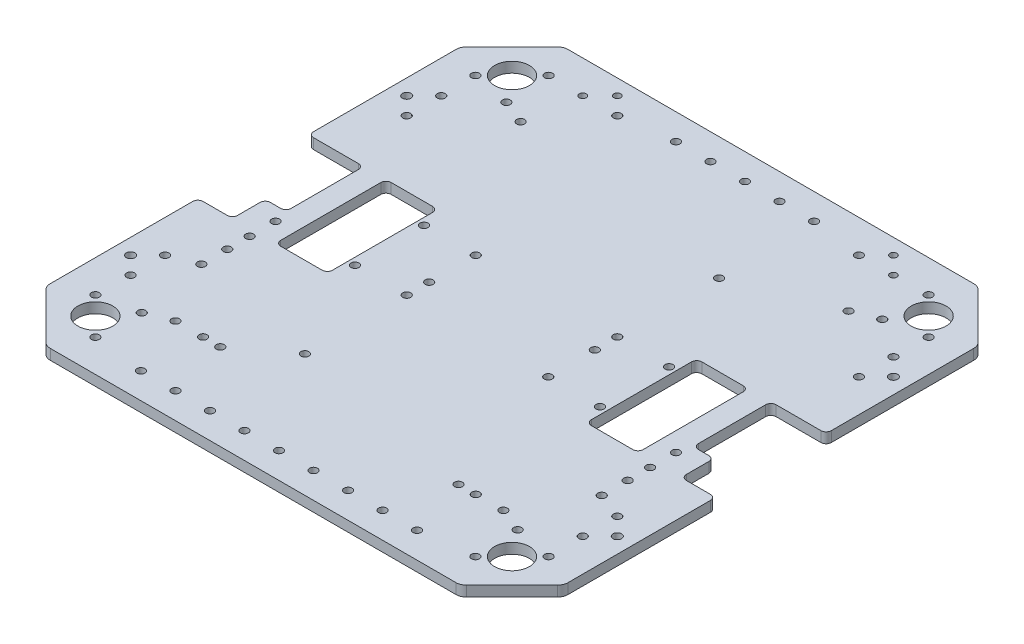
from build123d import *

# Parameters (mm, degrees)
BOSS_EXTRU_1_DEPTH                  = 6
ENL_V_MAT_EXTRU_1_REACH             = 214.217
ESQUISSE2_R                         = 10.1
ESQUISSE2_R_2                       = 2.3
SYM_TRIE2_COPY_1_REACH              = 214.217
SYM_TRIE2_COPY_1_SKETCH_R           = 10.1
SYM_TRIE2_COPY_1_SKETCH_R_2         = 2.3
ENL_V_MAT_EXTRU_2_REACH             = 214.217
ENL_V_MAT_EXTRU_2_DIRECTION_2_DEPTH = 213.216870206
CONG_1_R                            = 3
ENL_V_MAT_EXTRU_3_REACH             = 214.217
CONG_2_R                            = 3
ENL_V_MAT_EXTRU_4_REACH             = 214.217
ESQUISSE5_R                         = 2.3
ENL_V_MAT_EXTRU_5_REACH             = 214.217
ESQUISSE6_R                         = 2.3
ENL_V_MAT_EXTRU_6_REACH             = 214.217
ESQUISSE7_R                         = 2.476946043
ESQUISSE7_R_2                       = 2.3
ENL_V_MAT_EXTRU_7_REACH             = 214.217
ESQUISSE8_R                         = 2.3
ENL_V_MAT_EXTRU_8_REACH             = 214.217
ESQUISSE10_R                        = 2.3
CONG_3_R                            = 6
ENL_V_MAT_EXTRU_9_REACH             = 214.217
ESQUISSE11_R                        = 2.3
ENL_V_MAT_EXTRU_10_REACH            = 214.217
ESQUISSE12_R                        = 2.3
ENL_V_MAT_EXTRU_11_REACH            = 214.217
ESQUISSE13_R                        = 2.3
ENL_V_MAT_EXTRU_12_REACH            = 214.217
ESQUISSE14_R                        = 2.3
ESQUISSE14_R_2                      = 2
ENL_V_MAT_EXTRU_13_REACH            = 214.217
ESQUISSE15_W                        = 15
ESQUISSE15_H                        = 45
CONG_4_R                            = 3


with BuildPart() as part:
    # Esquisse1 → Boss.-Extru.1 (new body)
    with BuildSketch(Plane(origin=(0, 0, 0), x_dir=(1, 0, 0), z_dir=(0, 1, 0))):
        Polygon((-150, 0), (-150, 120), (-120, 150), (0, 150), (120, 150), (150, 120), (150, 0), (150, -120), (120, -150), (0, -150), (-120, -150), (-150, -120), align=None)
    extrude(amount=BOSS_EXTRU_1_DEPTH)

    # Esquisse2 → Enlèv. mat.-Extru.1 (cut, up to next)
    with BuildSketch(Plane(origin=(0, 6, 0), x_dir=(1, 0, 0), z_dir=(0, 1, 0)), mode=Mode.PRIVATE) as enl_v_mat_extru_1_sk1:
        with Locations(Location((-120.69746073, 120.69746073, 0), (0, 0, 270))):
            Circle(ESQUISSE2_R)
    enl_v_mat_extru_1_tool1 = extrude(enl_v_mat_extru_1_sk1.sketch, amount=-ENL_V_MAT_EXTRU_1_REACH, mode=Mode.PRIVATE) & part.part
    # Esquisse2 → Enlèv. mat.-Extru.1 (cut, up to next)
    with BuildSketch(Plane(origin=(0, 6, 0), x_dir=(1, 0, 0), z_dir=(0, 1, 0)), mode=Mode.PRIVATE) as enl_v_mat_extru_1_sk2:
        with Locations(Location((-131.304062448, 110.090859012, 0), (0, 0, 270))):
            Circle(ESQUISSE2_R_2)
    enl_v_mat_extru_1_tool2 = extrude(enl_v_mat_extru_1_sk2.sketch, amount=-ENL_V_MAT_EXTRU_1_REACH, mode=Mode.PRIVATE) & part.part
    # Esquisse2 → Enlèv. mat.-Extru.1 (cut, up to next)
    with BuildSketch(Plane(origin=(0, 6, 0), x_dir=(1, 0, 0), z_dir=(0, 1, 0)), mode=Mode.PRIVATE) as enl_v_mat_extru_1_sk3:
        with Locations(Location((-110.090859012, 131.304062448, 0), (0, 0, 270))):
            Circle(ESQUISSE2_R_2)
    enl_v_mat_extru_1_tool3 = extrude(enl_v_mat_extru_1_sk3.sketch, amount=-ENL_V_MAT_EXTRU_1_REACH, mode=Mode.PRIVATE) & part.part
    enl_v_mat_extru_1_1 = enl_v_mat_extru_1_tool1.solids().sort_by_distance((-120.697461, 6, -120.697461))[0]
    add(enl_v_mat_extru_1_1, mode=Mode.SUBTRACT)
    enl_v_mat_extru_1_2 = enl_v_mat_extru_1_tool2.solids().sort_by_distance((-131.304062, 6, -110.090859))[0]
    add(enl_v_mat_extru_1_2, mode=Mode.SUBTRACT)
    enl_v_mat_extru_1_3 = enl_v_mat_extru_1_tool3.solids().sort_by_distance((-110.090859, 6, -131.304062))[0]
    add(enl_v_mat_extru_1_3, mode=Mode.SUBTRACT)
    enl_v_mat_extru_1 = enl_v_mat_extru_1_1 + enl_v_mat_extru_1_2 + enl_v_mat_extru_1_3  # Enlèv. mat.-Extru.1 as one shape, for the pattern or mirror that repeats it

    # Symétrie1: Enlèv. mat.-Extru.1 across plane
    add(enl_v_mat_extru_1.mirror(Plane(origin=(0, 0, 0), x_dir=(0, 0, 1), z_dir=(1, 0, 0))), mode=Mode.SUBTRACT)

    # Symétrie2: Enlèv. mat.-Extru.1 across plane
    add(enl_v_mat_extru_1.mirror(Plane.XY), mode=Mode.SUBTRACT)

    # Symétrie2 copy 1 sketch → Symétrie2 copy 1 (cut, up to next)
    with BuildSketch(Plane(origin=(0, 6, 0), x_dir=(-1, 0, 0), z_dir=(0, 1, 0)), mode=Mode.PRIVATE) as sym_trie2_copy_1_sk1:
        with Locations(Location((-120.69746073, 120.69746073, 0), (0, 0, 270))):
            Circle(SYM_TRIE2_COPY_1_SKETCH_R)
    sym_trie2_copy_1_tool1 = extrude(sym_trie2_copy_1_sk1.sketch, amount=-SYM_TRIE2_COPY_1_REACH, mode=Mode.PRIVATE) & part.part
    # Symétrie2 copy 1 sketch → Symétrie2 copy 1 (cut, up to next)
    with BuildSketch(Plane(origin=(0, 6, 0), x_dir=(-1, 0, 0), z_dir=(0, 1, 0)), mode=Mode.PRIVATE) as sym_trie2_copy_1_sk2:
        with Locations(Location((-131.304062448, 110.090859012, 0), (0, 0, 270))):
            Circle(SYM_TRIE2_COPY_1_SKETCH_R_2)
    sym_trie2_copy_1_tool2 = extrude(sym_trie2_copy_1_sk2.sketch, amount=-SYM_TRIE2_COPY_1_REACH, mode=Mode.PRIVATE) & part.part
    # Symétrie2 copy 1 sketch → Symétrie2 copy 1 (cut, up to next)
    with BuildSketch(Plane(origin=(0, 6, 0), x_dir=(-1, 0, 0), z_dir=(0, 1, 0)), mode=Mode.PRIVATE) as sym_trie2_copy_1_sk3:
        with Locations(Location((-110.090859012, 131.304062448, 0), (0, 0, 270))):
            Circle(SYM_TRIE2_COPY_1_SKETCH_R_2)
    sym_trie2_copy_1_tool3 = extrude(sym_trie2_copy_1_sk3.sketch, amount=-SYM_TRIE2_COPY_1_REACH, mode=Mode.PRIVATE) & part.part
    add(sym_trie2_copy_1_tool1.solids().sort_by_distance((120.697461, 6, 120.697461))[0], mode=Mode.SUBTRACT)
    add(sym_trie2_copy_1_tool2.solids().sort_by_distance((131.304062, 6, 110.090859))[0], mode=Mode.SUBTRACT)
    add(sym_trie2_copy_1_tool3.solids().sort_by_distance((110.090859, 6, 131.304062))[0], mode=Mode.SUBTRACT)

    # Esquisse3 → Enlèv. mat.-Extru.2 (cut, up to next)
    with BuildSketch(Plane(origin=(0, 6, 0), x_dir=(1, 0, 0), z_dir=(0, 1, 0)), mode=Mode.PRIVATE) as enl_v_mat_extru_2_sk1:
        Polygon((-150, 0), (-150, -32), (-130, -32), (-130, 32), (-150, 32), align=None)
    enl_v_mat_extru_2_tool1 = extrude(enl_v_mat_extru_2_sk1.sketch, amount=-ENL_V_MAT_EXTRU_2_REACH, mode=Mode.PRIVATE) & part.part
    enl_v_mat_extru_2 = enl_v_mat_extru_2_tool1.solids().sort_by_distance((-140, 6, 0))[0]
    add(enl_v_mat_extru_2, mode=Mode.SUBTRACT)

    # Esquisse3 → Enlèv. mat.-Extru.2 direction 2 (cut)
    with BuildSketch(Plane(origin=(0, 6, 0), x_dir=(1, 0, 0), z_dir=(0, 1, 0))):
        Polygon((-150, 0), (-150, -32), (-130, -32), (-130, 32), (-150, 32), align=None)
    enl_v_mat_extru_2_direction_2 = extrude(amount=ENL_V_MAT_EXTRU_2_DIRECTION_2_DEPTH, mode=Mode.SUBTRACT)

    # Symétrie3: Enlèv. mat.-Extru.2, Enlèv. mat.-Extru.2 direction 2 across plane
    add(enl_v_mat_extru_2.mirror(Plane(origin=(0, 0, 0), x_dir=(0, 0, 1), z_dir=(1, 0, 0))), mode=Mode.SUBTRACT)
    add(enl_v_mat_extru_2_direction_2.mirror(Plane(origin=(0, 0, 0), x_dir=(0, 0, 1), z_dir=(1, 0, 0))), mode=Mode.SUBTRACT)

    # Congé1
    cong_1_edges = [part.edges().sort_by_distance(p)[0] for p in [
        (150, 3, 32),
        (150, 3, -32),
        (130, 3, -32),
        (130, 3, 32),
        (-150, 3, -32),
        (-150, 3, 32),
        (-130, 3, 32),
        (-130, 3, -32),
    ]]
    fillet(cong_1_edges, radius=CONG_1_R)

    # Esquisse4 → Enlèv. mat.-Extru.3 (cut, up to next)
    with BuildSketch(Plane(origin=(0, 6, 0), x_dir=(1, 0, 0), z_dir=(0, 1, 0)), mode=Mode.PRIVATE) as enl_v_mat_extru_3_sk1:
        Polygon((-105, 0), (-105, 32), (-75, 32), (-75, -32), (-105, -32), align=None)
    enl_v_mat_extru_3_tool1 = extrude(enl_v_mat_extru_3_sk1.sketch, amount=-ENL_V_MAT_EXTRU_3_REACH, mode=Mode.PRIVATE) & part.part
    enl_v_mat_extru_3 = enl_v_mat_extru_3_tool1.solids().sort_by_distance((-90, 6, 0))[0]
    add(enl_v_mat_extru_3, mode=Mode.SUBTRACT)

    # Symétrie4: Enlèv. mat.-Extru.3 across plane
    add(enl_v_mat_extru_3.mirror(Plane(origin=(0, 0, 0), x_dir=(0, 0, 1), z_dir=(1, 0, 0))), mode=Mode.SUBTRACT)

    # Congé2
    cong_2_edges = [part.edges().sort_by_distance(p)[0] for p in [
        (-105, 3, -32),
        (-75, 3, -32),
        (-75, 3, 32),
        (-105, 3, 32),
        (75, 3, -32),
        (105, 3, -32),
        (105, 3, 32),
        (75, 3, 32),
    ]]
    fillet(cong_2_edges, radius=CONG_2_R)

    # Esquisse5 → Enlèv. mat.-Extru.4 (cut, up to next)
    with BuildSketch(Plane(origin=(0, 6, 0), x_dir=(1, 0, 0), z_dir=(0, 1, 0)), mode=Mode.PRIVATE) as enl_v_mat_extru_4_sk1:
        with Locations(Location((-71, 20, 0), (0, 0, 270))):
            Circle(ESQUISSE5_R)
    enl_v_mat_extru_4_tool1 = extrude(enl_v_mat_extru_4_sk1.sketch, amount=-ENL_V_MAT_EXTRU_4_REACH, mode=Mode.PRIVATE) & part.part
    # Esquisse5 → Enlèv. mat.-Extru.4 (cut, up to next)
    with BuildSketch(Plane(origin=(0, 6, 0), x_dir=(1, 0, 0), z_dir=(0, 1, 0)), mode=Mode.PRIVATE) as enl_v_mat_extru_4_sk2:
        with Locations(Location((-71, -20, 0), (0, 0, 270))):
            Circle(ESQUISSE5_R)
    enl_v_mat_extru_4_tool2 = extrude(enl_v_mat_extru_4_sk2.sketch, amount=-ENL_V_MAT_EXTRU_4_REACH, mode=Mode.PRIVATE) & part.part
    enl_v_mat_extru_4_1 = enl_v_mat_extru_4_tool1.solids().sort_by_distance((-71, 6, -20))[0]
    add(enl_v_mat_extru_4_1, mode=Mode.SUBTRACT)
    enl_v_mat_extru_4_2 = enl_v_mat_extru_4_tool2.solids().sort_by_distance((-71, 6, 20))[0]
    add(enl_v_mat_extru_4_2, mode=Mode.SUBTRACT)
    enl_v_mat_extru_4 = enl_v_mat_extru_4_1 + enl_v_mat_extru_4_2  # Enlèv. mat.-Extru.4 as one shape, for the pattern or mirror that repeats it

    # Symétrie5: Enlèv. mat.-Extru.4 across plane
    add(enl_v_mat_extru_4.mirror(Plane(origin=(0, 0, 0), x_dir=(0, 0, 1), z_dir=(1, 0, 0))), mode=Mode.SUBTRACT)

    # Esquisse6 → Enlèv. mat.-Extru.5 (cut, up to next)
    with BuildSketch(Plane(origin=(0, 6, 0), x_dir=(1, 0, 0), z_dir=(0, 1, 0)), mode=Mode.PRIVATE) as enl_v_mat_extru_5_sk1:
        with Locations(Location((-41, -79, 0), (0, 0, 270))):
            Circle(ESQUISSE6_R)
    enl_v_mat_extru_5_tool1 = extrude(enl_v_mat_extru_5_sk1.sketch, amount=-ENL_V_MAT_EXTRU_5_REACH, mode=Mode.PRIVATE) & part.part
    # Esquisse6 → Enlèv. mat.-Extru.5 (cut, up to next)
    with BuildSketch(Plane(origin=(0, 6, 0), x_dir=(1, 0, 0), z_dir=(0, 1, 0)), mode=Mode.PRIVATE) as enl_v_mat_extru_5_sk2:
        with Locations(Location((-41, -20, 0), (0, 0, 270))):
            Circle(ESQUISSE6_R)
    enl_v_mat_extru_5_tool2 = extrude(enl_v_mat_extru_5_sk2.sketch, amount=-ENL_V_MAT_EXTRU_5_REACH, mode=Mode.PRIVATE) & part.part
    # Esquisse6 → Enlèv. mat.-Extru.5 (cut, up to next)
    with BuildSketch(Plane(origin=(0, 6, 0), x_dir=(1, 0, 0), z_dir=(0, 1, 0)), mode=Mode.PRIVATE) as enl_v_mat_extru_5_sk3:
        with Locations(Location((-41, 20, 0), (0, 0, 270))):
            Circle(ESQUISSE6_R)
    enl_v_mat_extru_5_tool3 = extrude(enl_v_mat_extru_5_sk3.sketch, amount=-ENL_V_MAT_EXTRU_5_REACH, mode=Mode.PRIVATE) & part.part
    # Esquisse6 → Enlèv. mat.-Extru.5 (cut, up to next)
    with BuildSketch(Plane(origin=(0, 6, 0), x_dir=(1, 0, 0), z_dir=(0, 1, 0)), mode=Mode.PRIVATE) as enl_v_mat_extru_5_sk4:
        with Locations(Location((41, -20, 0), (0, 0, 270))):
            Circle(ESQUISSE6_R)
    enl_v_mat_extru_5_tool4 = extrude(enl_v_mat_extru_5_sk4.sketch, amount=-ENL_V_MAT_EXTRU_5_REACH, mode=Mode.PRIVATE) & part.part
    # Esquisse6 → Enlèv. mat.-Extru.5 (cut, up to next)
    with BuildSketch(Plane(origin=(0, 6, 0), x_dir=(1, 0, 0), z_dir=(0, 1, 0)), mode=Mode.PRIVATE) as enl_v_mat_extru_5_sk5:
        with Locations(Location((41, 79, 0), (0, 0, 270))):
            Circle(ESQUISSE6_R)
    enl_v_mat_extru_5_tool5 = extrude(enl_v_mat_extru_5_sk5.sketch, amount=-ENL_V_MAT_EXTRU_5_REACH, mode=Mode.PRIVATE) & part.part
    # Esquisse6 → Enlèv. mat.-Extru.5 (cut, up to next)
    with BuildSketch(Plane(origin=(0, 6, 0), x_dir=(1, 0, 0), z_dir=(0, 1, 0)), mode=Mode.PRIVATE) as enl_v_mat_extru_5_sk6:
        with Locations(Location((41, 20, 0), (0, 0, 270))):
            Circle(ESQUISSE6_R)
    enl_v_mat_extru_5_tool6 = extrude(enl_v_mat_extru_5_sk6.sketch, amount=-ENL_V_MAT_EXTRU_5_REACH, mode=Mode.PRIVATE) & part.part
    # Esquisse6 → Enlèv. mat.-Extru.5 (cut, up to next)
    with BuildSketch(Plane(origin=(0, 6, 0), x_dir=(1, 0, 0), z_dir=(0, 1, 0)), mode=Mode.PRIVATE) as enl_v_mat_extru_5_sk7:
        with Locations(Location((41, 7, 0), (0, 0, 270))):
            Circle(ESQUISSE6_R)
    enl_v_mat_extru_5_tool7 = extrude(enl_v_mat_extru_5_sk7.sketch, amount=-ENL_V_MAT_EXTRU_5_REACH, mode=Mode.PRIVATE) & part.part
    # Esquisse6 → Enlèv. mat.-Extru.5 (cut, up to next)
    with BuildSketch(Plane(origin=(0, 6, 0), x_dir=(1, 0, 0), z_dir=(0, 1, 0)), mode=Mode.PRIVATE) as enl_v_mat_extru_5_sk8:
        with Locations(Location((-41, -7, 0), (0, 0, 270))):
            Circle(ESQUISSE6_R)
    enl_v_mat_extru_5_tool8 = extrude(enl_v_mat_extru_5_sk8.sketch, amount=-ENL_V_MAT_EXTRU_5_REACH, mode=Mode.PRIVATE) & part.part
    add(enl_v_mat_extru_5_tool1.solids().sort_by_distance((-41, 6, 79))[0], mode=Mode.SUBTRACT)
    add(enl_v_mat_extru_5_tool2.solids().sort_by_distance((-41, 6, 20))[0], mode=Mode.SUBTRACT)
    add(enl_v_mat_extru_5_tool3.solids().sort_by_distance((-41, 6, -20))[0], mode=Mode.SUBTRACT)
    add(enl_v_mat_extru_5_tool4.solids().sort_by_distance((41, 6, 20))[0], mode=Mode.SUBTRACT)
    add(enl_v_mat_extru_5_tool5.solids().sort_by_distance((41, 6, -79))[0], mode=Mode.SUBTRACT)
    add(enl_v_mat_extru_5_tool6.solids().sort_by_distance((41, 6, -20))[0], mode=Mode.SUBTRACT)
    add(enl_v_mat_extru_5_tool7.solids().sort_by_distance((41, 6, -7))[0], mode=Mode.SUBTRACT)
    add(enl_v_mat_extru_5_tool8.solids().sort_by_distance((-41, 6, 7))[0], mode=Mode.SUBTRACT)

    # Esquisse7 → Enlèv. mat.-Extru.6 (cut, up to next)
    with BuildSketch(Plane(origin=(0, 6, 0), x_dir=(1, 0, 0), z_dir=(0, 1, 0)), mode=Mode.PRIVATE) as enl_v_mat_extru_6_sk1:
        with Locations(Location((141, -80, 0), (0, 0, 270))):
            Circle(ESQUISSE7_R)
    enl_v_mat_extru_6_tool1 = extrude(enl_v_mat_extru_6_sk1.sketch, amount=-ENL_V_MAT_EXTRU_6_REACH, mode=Mode.PRIVATE) & part.part
    # Esquisse7 → Enlèv. mat.-Extru.6 (cut, up to next)
    with BuildSketch(Plane(origin=(0, 6, 0), x_dir=(1, 0, 0), z_dir=(0, 1, 0)), mode=Mode.PRIVATE) as enl_v_mat_extru_6_sk2:
        with Locations(Location((131, -90, 0), (0, 0, 270))):
            Circle(ESQUISSE7_R_2)
    enl_v_mat_extru_6_tool2 = extrude(enl_v_mat_extru_6_sk2.sketch, amount=-ENL_V_MAT_EXTRU_6_REACH, mode=Mode.PRIVATE) & part.part
    # Esquisse7 → Enlèv. mat.-Extru.6 (cut, up to next)
    with BuildSketch(Plane(origin=(0, 6, 0), x_dir=(1, 0, 0), z_dir=(0, 1, 0)), mode=Mode.PRIVATE) as enl_v_mat_extru_6_sk3:
        with Locations(Location((131, -70, 0), (0, 0, 270))):
            Circle(ESQUISSE7_R_2)
    enl_v_mat_extru_6_tool3 = extrude(enl_v_mat_extru_6_sk3.sketch, amount=-ENL_V_MAT_EXTRU_6_REACH, mode=Mode.PRIVATE) & part.part
    # Esquisse7 → Enlèv. mat.-Extru.6 (cut, up to next)
    with BuildSketch(Plane(origin=(0, 6, 0), x_dir=(1, 0, 0), z_dir=(0, 1, 0)), mode=Mode.PRIVATE) as enl_v_mat_extru_6_sk4:
        with Locations(Location((131, 70, 0), (0, 0, 270))):
            Circle(ESQUISSE7_R_2)
    enl_v_mat_extru_6_tool4 = extrude(enl_v_mat_extru_6_sk4.sketch, amount=-ENL_V_MAT_EXTRU_6_REACH, mode=Mode.PRIVATE) & part.part
    # Esquisse7 → Enlèv. mat.-Extru.6 (cut, up to next)
    with BuildSketch(Plane(origin=(0, 6, 0), x_dir=(1, 0, 0), z_dir=(0, 1, 0)), mode=Mode.PRIVATE) as enl_v_mat_extru_6_sk5:
        with Locations(Location((131, 90, 0), (0, 0, 270))):
            Circle(ESQUISSE7_R_2)
    enl_v_mat_extru_6_tool5 = extrude(enl_v_mat_extru_6_sk5.sketch, amount=-ENL_V_MAT_EXTRU_6_REACH, mode=Mode.PRIVATE) & part.part
    # Esquisse7 → Enlèv. mat.-Extru.6 (cut, up to next)
    with BuildSketch(Plane(origin=(0, 6, 0), x_dir=(1, 0, 0), z_dir=(0, 1, 0)), mode=Mode.PRIVATE) as enl_v_mat_extru_6_sk6:
        with Locations(Location((141, 80, 0), (0, 0, 270))):
            Circle(ESQUISSE7_R)
    enl_v_mat_extru_6_tool6 = extrude(enl_v_mat_extru_6_sk6.sketch, amount=-ENL_V_MAT_EXTRU_6_REACH, mode=Mode.PRIVATE) & part.part
    enl_v_mat_extru_6_1 = enl_v_mat_extru_6_tool1.solids().sort_by_distance((141, 6, 80))[0]
    add(enl_v_mat_extru_6_1, mode=Mode.SUBTRACT)
    enl_v_mat_extru_6_2 = enl_v_mat_extru_6_tool2.solids().sort_by_distance((131, 6, 90))[0]
    add(enl_v_mat_extru_6_2, mode=Mode.SUBTRACT)
    enl_v_mat_extru_6_3 = enl_v_mat_extru_6_tool3.solids().sort_by_distance((131, 6, 70))[0]
    add(enl_v_mat_extru_6_3, mode=Mode.SUBTRACT)
    enl_v_mat_extru_6_4 = enl_v_mat_extru_6_tool4.solids().sort_by_distance((131, 6, -70))[0]
    add(enl_v_mat_extru_6_4, mode=Mode.SUBTRACT)
    enl_v_mat_extru_6_5 = enl_v_mat_extru_6_tool5.solids().sort_by_distance((131, 6, -90))[0]
    add(enl_v_mat_extru_6_5, mode=Mode.SUBTRACT)
    enl_v_mat_extru_6_6 = enl_v_mat_extru_6_tool6.solids().sort_by_distance((141, 6, -80))[0]
    add(enl_v_mat_extru_6_6, mode=Mode.SUBTRACT)
    enl_v_mat_extru_6 = enl_v_mat_extru_6_1 + enl_v_mat_extru_6_2 + enl_v_mat_extru_6_3 + enl_v_mat_extru_6_4 + enl_v_mat_extru_6_5 + enl_v_mat_extru_6_6  # Enlèv. mat.-Extru.6 as one shape, for the pattern or mirror that repeats it

    # Symétrie6: Enlèv. mat.-Extru.6 across plane
    add(enl_v_mat_extru_6.mirror(Plane(origin=(0, 0, 0), x_dir=(0, 0, 1), z_dir=(1, 0, 0))), mode=Mode.SUBTRACT)

    # Esquisse8 → Enlèv. mat.-Extru.7 (cut, up to next)
    with BuildSketch(Plane(origin=(0, 6, 0), x_dir=(1, 0, 0), z_dir=(0, 1, 0)), mode=Mode.PRIVATE) as enl_v_mat_extru_7_sk1:
        with Locations(Location((-80, -135, 0), (0, 0, 270))):
            Circle(ESQUISSE8_R)
    enl_v_mat_extru_7_tool1 = extrude(enl_v_mat_extru_7_sk1.sketch, amount=-ENL_V_MAT_EXTRU_7_REACH, mode=Mode.PRIVATE) & part.part
    # Esquisse8 → Enlèv. mat.-Extru.7 (cut, up to next)
    with BuildSketch(Plane(origin=(0, 6, 0), x_dir=(1, 0, 0), z_dir=(0, 1, 0)), mode=Mode.PRIVATE) as enl_v_mat_extru_7_sk2:
        with Locations(Location((80, -135, 0), (0, 0, 270))):
            Circle(ESQUISSE8_R)
    enl_v_mat_extru_7_tool2 = extrude(enl_v_mat_extru_7_sk2.sketch, amount=-ENL_V_MAT_EXTRU_7_REACH, mode=Mode.PRIVATE) & part.part
    # Esquisse8 → Enlèv. mat.-Extru.7 (cut, up to next)
    with BuildSketch(Plane(origin=(0, 6, 0), x_dir=(1, 0, 0), z_dir=(0, 1, 0)), mode=Mode.PRIVATE) as enl_v_mat_extru_7_sk3:
        with Locations(Location((-60, -135, 0), (0, 0, 270))):
            Circle(ESQUISSE8_R)
    enl_v_mat_extru_7_tool3 = extrude(enl_v_mat_extru_7_sk3.sketch, amount=-ENL_V_MAT_EXTRU_7_REACH, mode=Mode.PRIVATE) & part.part
    # Esquisse8 → Enlèv. mat.-Extru.7 (cut, up to next)
    with BuildSketch(Plane(origin=(0, 6, 0), x_dir=(1, 0, 0), z_dir=(0, 1, 0)), mode=Mode.PRIVATE) as enl_v_mat_extru_7_sk4:
        with Locations(Location((-40, -135, 0), (0, 0, 270))):
            Circle(ESQUISSE8_R)
    enl_v_mat_extru_7_tool4 = extrude(enl_v_mat_extru_7_sk4.sketch, amount=-ENL_V_MAT_EXTRU_7_REACH, mode=Mode.PRIVATE) & part.part
    # Esquisse8 → Enlèv. mat.-Extru.7 (cut, up to next)
    with BuildSketch(Plane(origin=(0, 6, 0), x_dir=(1, 0, 0), z_dir=(0, 1, 0)), mode=Mode.PRIVATE) as enl_v_mat_extru_7_sk5:
        with Locations(Location((-20, -135, 0), (0, 0, 270))):
            Circle(ESQUISSE8_R)
    enl_v_mat_extru_7_tool5 = extrude(enl_v_mat_extru_7_sk5.sketch, amount=-ENL_V_MAT_EXTRU_7_REACH, mode=Mode.PRIVATE) & part.part
    # Esquisse8 → Enlèv. mat.-Extru.7 (cut, up to next)
    with BuildSketch(Plane(origin=(0, 6, 0), x_dir=(1, 0, 0), z_dir=(0, 1, 0)), mode=Mode.PRIVATE) as enl_v_mat_extru_7_sk6:
        with Locations(Location((0, -135, 0), (0, 0, 270))):
            Circle(ESQUISSE8_R)
    enl_v_mat_extru_7_tool6 = extrude(enl_v_mat_extru_7_sk6.sketch, amount=-ENL_V_MAT_EXTRU_7_REACH, mode=Mode.PRIVATE) & part.part
    # Esquisse8 → Enlèv. mat.-Extru.7 (cut, up to next)
    with BuildSketch(Plane(origin=(0, 6, 0), x_dir=(1, 0, 0), z_dir=(0, 1, 0)), mode=Mode.PRIVATE) as enl_v_mat_extru_7_sk7:
        with Locations(Location((20, -135, 0), (0, 0, 270))):
            Circle(ESQUISSE8_R)
    enl_v_mat_extru_7_tool7 = extrude(enl_v_mat_extru_7_sk7.sketch, amount=-ENL_V_MAT_EXTRU_7_REACH, mode=Mode.PRIVATE) & part.part
    # Esquisse8 → Enlèv. mat.-Extru.7 (cut, up to next)
    with BuildSketch(Plane(origin=(0, 6, 0), x_dir=(1, 0, 0), z_dir=(0, 1, 0)), mode=Mode.PRIVATE) as enl_v_mat_extru_7_sk8:
        with Locations(Location((40, -135, 0), (0, 0, 270))):
            Circle(ESQUISSE8_R)
    enl_v_mat_extru_7_tool8 = extrude(enl_v_mat_extru_7_sk8.sketch, amount=-ENL_V_MAT_EXTRU_7_REACH, mode=Mode.PRIVATE) & part.part
    # Esquisse8 → Enlèv. mat.-Extru.7 (cut, up to next)
    with BuildSketch(Plane(origin=(0, 6, 0), x_dir=(1, 0, 0), z_dir=(0, 1, 0)), mode=Mode.PRIVATE) as enl_v_mat_extru_7_sk9:
        with Locations(Location((60, -135, 0), (0, 0, 270))):
            Circle(ESQUISSE8_R)
    enl_v_mat_extru_7_tool9 = extrude(enl_v_mat_extru_7_sk9.sketch, amount=-ENL_V_MAT_EXTRU_7_REACH, mode=Mode.PRIVATE) & part.part
    # Esquisse8 → Enlèv. mat.-Extru.7 (cut, up to next)
    with BuildSketch(Plane(origin=(0, 6, 0), x_dir=(1, 0, 0), z_dir=(0, 1, 0)), mode=Mode.PRIVATE) as enl_v_mat_extru_7_sk10:
        with Locations(Location((40, 135, 0), (0, 0, 270))):
            Circle(ESQUISSE8_R)
    enl_v_mat_extru_7_tool10 = extrude(enl_v_mat_extru_7_sk10.sketch, amount=-ENL_V_MAT_EXTRU_7_REACH, mode=Mode.PRIVATE) & part.part
    # Esquisse8 → Enlèv. mat.-Extru.7 (cut, up to next)
    with BuildSketch(Plane(origin=(0, 6, 0), x_dir=(1, 0, 0), z_dir=(0, 1, 0)), mode=Mode.PRIVATE) as enl_v_mat_extru_7_sk11:
        with Locations(Location((20, 135, 0), (0, 0, 270))):
            Circle(ESQUISSE8_R)
    enl_v_mat_extru_7_tool11 = extrude(enl_v_mat_extru_7_sk11.sketch, amount=-ENL_V_MAT_EXTRU_7_REACH, mode=Mode.PRIVATE) & part.part
    # Esquisse8 → Enlèv. mat.-Extru.7 (cut, up to next)
    with BuildSketch(Plane(origin=(0, 6, 0), x_dir=(1, 0, 0), z_dir=(0, 1, 0)), mode=Mode.PRIVATE) as enl_v_mat_extru_7_sk12:
        with Locations(Location((0, 135, 0), (0, 0, 270))):
            Circle(ESQUISSE8_R)
    enl_v_mat_extru_7_tool12 = extrude(enl_v_mat_extru_7_sk12.sketch, amount=-ENL_V_MAT_EXTRU_7_REACH, mode=Mode.PRIVATE) & part.part
    # Esquisse8 → Enlèv. mat.-Extru.7 (cut, up to next)
    with BuildSketch(Plane(origin=(0, 6, 0), x_dir=(1, 0, 0), z_dir=(0, 1, 0)), mode=Mode.PRIVATE) as enl_v_mat_extru_7_sk13:
        with Locations(Location((-20, 135, 0), (0, 0, 270))):
            Circle(ESQUISSE8_R)
    enl_v_mat_extru_7_tool13 = extrude(enl_v_mat_extru_7_sk13.sketch, amount=-ENL_V_MAT_EXTRU_7_REACH, mode=Mode.PRIVATE) & part.part
    # Esquisse8 → Enlèv. mat.-Extru.7 (cut, up to next)
    with BuildSketch(Plane(origin=(0, 6, 0), x_dir=(1, 0, 0), z_dir=(0, 1, 0)), mode=Mode.PRIVATE) as enl_v_mat_extru_7_sk14:
        with Locations(Location((-40, 135, 0), (0, 0, 270))):
            Circle(ESQUISSE8_R)
    enl_v_mat_extru_7_tool14 = extrude(enl_v_mat_extru_7_sk14.sketch, amount=-ENL_V_MAT_EXTRU_7_REACH, mode=Mode.PRIVATE) & part.part
    add(enl_v_mat_extru_7_tool1.solids().sort_by_distance((-80, 6, 135))[0], mode=Mode.SUBTRACT)
    add(enl_v_mat_extru_7_tool2.solids().sort_by_distance((80, 6, 135))[0], mode=Mode.SUBTRACT)
    add(enl_v_mat_extru_7_tool3.solids().sort_by_distance((-60, 6, 135))[0], mode=Mode.SUBTRACT)
    add(enl_v_mat_extru_7_tool4.solids().sort_by_distance((-40, 6, 135))[0], mode=Mode.SUBTRACT)
    add(enl_v_mat_extru_7_tool5.solids().sort_by_distance((-20, 6, 135))[0], mode=Mode.SUBTRACT)
    add(enl_v_mat_extru_7_tool6.solids().sort_by_distance((0, 6, 135))[0], mode=Mode.SUBTRACT)
    add(enl_v_mat_extru_7_tool7.solids().sort_by_distance((20, 6, 135))[0], mode=Mode.SUBTRACT)
    add(enl_v_mat_extru_7_tool8.solids().sort_by_distance((40, 6, 135))[0], mode=Mode.SUBTRACT)
    add(enl_v_mat_extru_7_tool9.solids().sort_by_distance((60, 6, 135))[0], mode=Mode.SUBTRACT)
    add(enl_v_mat_extru_7_tool10.solids().sort_by_distance((40, 6, -135))[0], mode=Mode.SUBTRACT)
    add(enl_v_mat_extru_7_tool11.solids().sort_by_distance((20, 6, -135))[0], mode=Mode.SUBTRACT)
    add(enl_v_mat_extru_7_tool12.solids().sort_by_distance((0, 6, -135))[0], mode=Mode.SUBTRACT)
    add(enl_v_mat_extru_7_tool13.solids().sort_by_distance((-20, 6, -135))[0], mode=Mode.SUBTRACT)
    add(enl_v_mat_extru_7_tool14.solids().sort_by_distance((-40, 6, -135))[0], mode=Mode.SUBTRACT)

    # Esquisse10 → Enlèv. mat.-Extru.8 (cut, up to next)
    with BuildSketch(Plane(origin=(0, 6, 0), x_dir=(1, 0, 0), z_dir=(0, 1, 0)), mode=Mode.PRIVATE) as enl_v_mat_extru_8_sk1:
        with Locations(Location((-116, -36, 0), (0, 0, 270))):
            Circle(ESQUISSE10_R)
    enl_v_mat_extru_8_tool1 = extrude(enl_v_mat_extru_8_sk1.sketch, amount=-ENL_V_MAT_EXTRU_8_REACH, mode=Mode.PRIVATE) & part.part
    # Esquisse10 → Enlèv. mat.-Extru.8 (cut, up to next)
    with BuildSketch(Plane(origin=(0, 6, 0), x_dir=(1, 0, 0), z_dir=(0, 1, 0)), mode=Mode.PRIVATE) as enl_v_mat_extru_8_sk2:
        with Locations(Location((-116, -64, 0), (0, 0, 270))):
            Circle(ESQUISSE10_R)
    enl_v_mat_extru_8_tool2 = extrude(enl_v_mat_extru_8_sk2.sketch, amount=-ENL_V_MAT_EXTRU_8_REACH, mode=Mode.PRIVATE) & part.part
    enl_v_mat_extru_8_1 = enl_v_mat_extru_8_tool1.solids().sort_by_distance((-116, 6, 36))[0]
    add(enl_v_mat_extru_8_1, mode=Mode.SUBTRACT)
    enl_v_mat_extru_8_2 = enl_v_mat_extru_8_tool2.solids().sort_by_distance((-116, 6, 64))[0]
    add(enl_v_mat_extru_8_2, mode=Mode.SUBTRACT)
    enl_v_mat_extru_8 = enl_v_mat_extru_8_1 + enl_v_mat_extru_8_2  # Enlèv. mat.-Extru.8 as one shape, for the pattern or mirror that repeats it

    # Symétrie8: Enlèv. mat.-Extru.8 across plane
    add(enl_v_mat_extru_8.mirror(Plane(origin=(0, 0, 0), x_dir=(0, 0, 1), z_dir=(1, 0, 0))), mode=Mode.SUBTRACT)

    # Congé3
    cong_3_edges = [part.edges().sort_by_distance(p)[0] for p in [
        (-150, 3, -120),
        (-120, 3, -150),
        (120, 3, -150),
        (150, 3, -120),
        (150, 3, 120),
        (120, 3, 150),
        (-120, 3, 150),
        (-150, 3, 120),
    ]]
    fillet(cong_3_edges, radius=CONG_3_R)

    # Esquisse11 → Enlèv. mat.-Extru.9 (cut, up to next)
    with BuildSketch(Plane(origin=(0, 6, 0), x_dir=(1, 0, 0), z_dir=(0, 1, 0)), mode=Mode.PRIVATE) as enl_v_mat_extru_9_sk1:
        with Locations(Location((-116, -21, 0), (0, 0, 270))):
            Circle(ESQUISSE11_R)
    enl_v_mat_extru_9_tool1 = extrude(enl_v_mat_extru_9_sk1.sketch, amount=-ENL_V_MAT_EXTRU_9_REACH, mode=Mode.PRIVATE) & part.part
    # Esquisse11 → Enlèv. mat.-Extru.9 (cut, up to next)
    with BuildSketch(Plane(origin=(0, 6, 0), x_dir=(1, 0, 0), z_dir=(0, 1, 0)), mode=Mode.PRIVATE) as enl_v_mat_extru_9_sk2:
        with Locations(Location((-116, -49, 0), (0, 0, 270))):
            Circle(ESQUISSE11_R)
    enl_v_mat_extru_9_tool2 = extrude(enl_v_mat_extru_9_sk2.sketch, amount=-ENL_V_MAT_EXTRU_9_REACH, mode=Mode.PRIVATE) & part.part
    # Esquisse11 → Enlèv. mat.-Extru.9 (cut, up to next)
    with BuildSketch(Plane(origin=(0, 6, 0), x_dir=(1, 0, 0), z_dir=(0, 1, 0)), mode=Mode.PRIVATE) as enl_v_mat_extru_9_sk3:
        with Locations(Location((116, -49, 0), (0, 0, 270))):
            Circle(ESQUISSE11_R)
    enl_v_mat_extru_9_tool3 = extrude(enl_v_mat_extru_9_sk3.sketch, amount=-ENL_V_MAT_EXTRU_9_REACH, mode=Mode.PRIVATE) & part.part
    # Esquisse11 → Enlèv. mat.-Extru.9 (cut, up to next)
    with BuildSketch(Plane(origin=(0, 6, 0), x_dir=(1, 0, 0), z_dir=(0, 1, 0)), mode=Mode.PRIVATE) as enl_v_mat_extru_9_sk4:
        with Locations(Location((116, -21, 0), (0, 0, 270))):
            Circle(ESQUISSE11_R)
    enl_v_mat_extru_9_tool4 = extrude(enl_v_mat_extru_9_sk4.sketch, amount=-ENL_V_MAT_EXTRU_9_REACH, mode=Mode.PRIVATE) & part.part
    add(enl_v_mat_extru_9_tool1.solids().sort_by_distance((-116, 6, 21))[0], mode=Mode.SUBTRACT)
    add(enl_v_mat_extru_9_tool2.solids().sort_by_distance((-116, 6, 49))[0], mode=Mode.SUBTRACT)
    add(enl_v_mat_extru_9_tool3.solids().sort_by_distance((116, 6, 49))[0], mode=Mode.SUBTRACT)
    add(enl_v_mat_extru_9_tool4.solids().sort_by_distance((116, 6, 21))[0], mode=Mode.SUBTRACT)

    # Esquisse12 → Enlèv. mat.-Extru.10 (cut, up to next)
    with BuildSketch(Plane(origin=(0, 6, 0), x_dir=(1, 0, 0), z_dir=(0, 1, 0)), mode=Mode.PRIVATE) as enl_v_mat_extru_10_sk1:
        with Locations(Location((-95, -100, 0), (0, 0, 270))):
            Circle(ESQUISSE12_R)
    enl_v_mat_extru_10_tool1 = extrude(enl_v_mat_extru_10_sk1.sketch, amount=-ENL_V_MAT_EXTRU_10_REACH, mode=Mode.PRIVATE) & part.part
    # Esquisse12 → Enlèv. mat.-Extru.10 (cut, up to next)
    with BuildSketch(Plane(origin=(0, 6, 0), x_dir=(1, 0, 0), z_dir=(0, 1, 0)), mode=Mode.PRIVATE) as enl_v_mat_extru_10_sk2:
        with Locations(Location((-108.907757819, -105.619098901, 0), (0, 0, 270))):
            Circle(ESQUISSE12_R)
    enl_v_mat_extru_10_tool2 = extrude(enl_v_mat_extru_10_sk2.sketch, amount=-ENL_V_MAT_EXTRU_10_REACH, mode=Mode.PRIVATE) & part.part
    # Esquisse12 → Enlèv. mat.-Extru.10 (cut, up to next)
    with BuildSketch(Plane(origin=(0, 6, 0), x_dir=(1, 0, 0), z_dir=(0, 1, 0)), mode=Mode.PRIVATE) as enl_v_mat_extru_10_sk3:
        with Locations(Location((108.907757819, -105.619098901, 0), (0, 0, 270))):
            Circle(ESQUISSE12_R)
    enl_v_mat_extru_10_tool3 = extrude(enl_v_mat_extru_10_sk3.sketch, amount=-ENL_V_MAT_EXTRU_10_REACH, mode=Mode.PRIVATE) & part.part
    # Esquisse12 → Enlèv. mat.-Extru.10 (cut, up to next)
    with BuildSketch(Plane(origin=(0, 6, 0), x_dir=(1, 0, 0), z_dir=(0, 1, 0)), mode=Mode.PRIVATE) as enl_v_mat_extru_10_sk4:
        with Locations(Location((95, -100, 0), (0, 0, 270))):
            Circle(ESQUISSE12_R)
    enl_v_mat_extru_10_tool4 = extrude(enl_v_mat_extru_10_sk4.sketch, amount=-ENL_V_MAT_EXTRU_10_REACH, mode=Mode.PRIVATE) & part.part
    enl_v_mat_extru_10_1 = enl_v_mat_extru_10_tool1.solids().sort_by_distance((-95, 6, 100))[0]
    add(enl_v_mat_extru_10_1, mode=Mode.SUBTRACT)
    enl_v_mat_extru_10_2 = enl_v_mat_extru_10_tool2.solids().sort_by_distance((-108.907758, 6, 105.619099))[0]
    add(enl_v_mat_extru_10_2, mode=Mode.SUBTRACT)
    enl_v_mat_extru_10_3 = enl_v_mat_extru_10_tool3.solids().sort_by_distance((108.907758, 6, 105.619099))[0]
    add(enl_v_mat_extru_10_3, mode=Mode.SUBTRACT)
    enl_v_mat_extru_10_4 = enl_v_mat_extru_10_tool4.solids().sort_by_distance((95, 6, 100))[0]
    add(enl_v_mat_extru_10_4, mode=Mode.SUBTRACT)
    enl_v_mat_extru_10 = enl_v_mat_extru_10_1 + enl_v_mat_extru_10_2 + enl_v_mat_extru_10_3 + enl_v_mat_extru_10_4  # Enlèv. mat.-Extru.10 as one shape, for the pattern or mirror that repeats it

    # Symétrie9: Enlèv. mat.-Extru.10 across plane
    add(enl_v_mat_extru_10.mirror(Plane.XY), mode=Mode.SUBTRACT)

    # Esquisse13 → Enlèv. mat.-Extru.11 (cut, up to next)
    with BuildSketch(Plane(origin=(0, 6, 0), x_dir=(1, 0, 0), z_dir=(0, 1, 0)), mode=Mode.PRIVATE) as enl_v_mat_extru_11_sk1:
        with Locations(Location((-79, -100, 0), (0, 0, 270))):
            Circle(ESQUISSE13_R)
    enl_v_mat_extru_11_tool1 = extrude(enl_v_mat_extru_11_sk1.sketch, amount=-ENL_V_MAT_EXTRU_11_REACH, mode=Mode.PRIVATE) & part.part
    # Esquisse13 → Enlèv. mat.-Extru.11 (cut, up to next)
    with BuildSketch(Plane(origin=(0, 6, 0), x_dir=(1, 0, 0), z_dir=(0, 1, 0)), mode=Mode.PRIVATE) as enl_v_mat_extru_11_sk2:
        with Locations(Location((-69, -100, 0), (0, 0, 270))):
            Circle(ESQUISSE13_R)
    enl_v_mat_extru_11_tool2 = extrude(enl_v_mat_extru_11_sk2.sketch, amount=-ENL_V_MAT_EXTRU_11_REACH, mode=Mode.PRIVATE) & part.part
    # Esquisse13 → Enlèv. mat.-Extru.11 (cut, up to next)
    with BuildSketch(Plane(origin=(0, 6, 0), x_dir=(1, 0, 0), z_dir=(0, 1, 0)), mode=Mode.PRIVATE) as enl_v_mat_extru_11_sk3:
        with Locations(Location((69, -100, 0), (0, 0, 270))):
            Circle(ESQUISSE13_R)
    enl_v_mat_extru_11_tool3 = extrude(enl_v_mat_extru_11_sk3.sketch, amount=-ENL_V_MAT_EXTRU_11_REACH, mode=Mode.PRIVATE) & part.part
    # Esquisse13 → Enlèv. mat.-Extru.11 (cut, up to next)
    with BuildSketch(Plane(origin=(0, 6, 0), x_dir=(1, 0, 0), z_dir=(0, 1, 0)), mode=Mode.PRIVATE) as enl_v_mat_extru_11_sk4:
        with Locations(Location((79, -100, 0), (0, 0, 270))):
            Circle(ESQUISSE13_R)
    enl_v_mat_extru_11_tool4 = extrude(enl_v_mat_extru_11_sk4.sketch, amount=-ENL_V_MAT_EXTRU_11_REACH, mode=Mode.PRIVATE) & part.part
    add(enl_v_mat_extru_11_tool1.solids().sort_by_distance((-79, 6, 100))[0], mode=Mode.SUBTRACT)
    add(enl_v_mat_extru_11_tool2.solids().sort_by_distance((-69, 6, 100))[0], mode=Mode.SUBTRACT)
    add(enl_v_mat_extru_11_tool3.solids().sort_by_distance((69, 6, 100))[0], mode=Mode.SUBTRACT)
    add(enl_v_mat_extru_11_tool4.solids().sort_by_distance((79, 6, 100))[0], mode=Mode.SUBTRACT)

    # Esquisse14 → Enlèv. mat.-Extru.12 (cut, up to next)
    with BuildSketch(Plane(origin=(0, 6, 0), x_dir=(1, 0, 0), z_dir=(0, 1, 0)), mode=Mode.PRIVATE) as enl_v_mat_extru_12_sk1:
        with Locations(Location((70, 131, 0), (0, 0, 270))):
            Circle(ESQUISSE14_R)
    enl_v_mat_extru_12_tool1 = extrude(enl_v_mat_extru_12_sk1.sketch, amount=-ENL_V_MAT_EXTRU_12_REACH, mode=Mode.PRIVATE) & part.part
    # Esquisse14 → Enlèv. mat.-Extru.12 (cut, up to next)
    with BuildSketch(Plane(origin=(0, 6, 0), x_dir=(1, 0, 0), z_dir=(0, 1, 0)), mode=Mode.PRIVATE) as enl_v_mat_extru_12_sk2:
        with Locations(Location((90, 131, 0), (0, 0, 270))):
            Circle(ESQUISSE14_R_2)
    enl_v_mat_extru_12_tool2 = extrude(enl_v_mat_extru_12_sk2.sketch, amount=-ENL_V_MAT_EXTRU_12_REACH, mode=Mode.PRIVATE) & part.part
    # Esquisse14 → Enlèv. mat.-Extru.12 (cut, up to next)
    with BuildSketch(Plane(origin=(0, 6, 0), x_dir=(1, 0, 0), z_dir=(0, 1, 0)), mode=Mode.PRIVATE) as enl_v_mat_extru_12_sk3:
        with Locations(Location((80, 141, 0), (0, 0, 270))):
            Circle(ESQUISSE14_R_2)
    enl_v_mat_extru_12_tool3 = extrude(enl_v_mat_extru_12_sk3.sketch, amount=-ENL_V_MAT_EXTRU_12_REACH, mode=Mode.PRIVATE) & part.part
    enl_v_mat_extru_12_1 = enl_v_mat_extru_12_tool1.solids().sort_by_distance((70, 6, -131))[0]
    add(enl_v_mat_extru_12_1, mode=Mode.SUBTRACT)
    enl_v_mat_extru_12_2 = enl_v_mat_extru_12_tool2.solids().sort_by_distance((90, 6, -131))[0]
    add(enl_v_mat_extru_12_2, mode=Mode.SUBTRACT)
    enl_v_mat_extru_12_3 = enl_v_mat_extru_12_tool3.solids().sort_by_distance((80, 6, -141))[0]
    add(enl_v_mat_extru_12_3, mode=Mode.SUBTRACT)
    enl_v_mat_extru_12 = enl_v_mat_extru_12_1 + enl_v_mat_extru_12_2 + enl_v_mat_extru_12_3  # Enlèv. mat.-Extru.12 as one shape, for the pattern or mirror that repeats it

    # Symétrie10: Enlèv. mat.-Extru.12 across plane
    add(enl_v_mat_extru_12.mirror(Plane(origin=(0, 0, 0), x_dir=(0, 0, 1), z_dir=(1, 0, 0))), mode=Mode.SUBTRACT)

    # Esquisse15 → Enlèv. mat.-Extru.13 (cut, up to next)
    with BuildSketch(Plane(origin=(0, 6, 0), x_dir=(1, 0, 0), z_dir=(0, 1, 0)), mode=Mode.PRIVATE) as enl_v_mat_extru_13_sk1:
        with Locations((-125.5, 9.5)):
            Rectangle(ESQUISSE15_W, ESQUISSE15_H)
    enl_v_mat_extru_13_tool1 = extrude(enl_v_mat_extru_13_sk1.sketch, amount=-ENL_V_MAT_EXTRU_13_REACH, mode=Mode.PRIVATE) & part.part
    enl_v_mat_extru_13 = enl_v_mat_extru_13_tool1.solids().sort_by_distance((-125.5, 6, -9.5))[0]
    add(enl_v_mat_extru_13, mode=Mode.SUBTRACT)

    # Symétrie11: Enlèv. mat.-Extru.13 across plane
    add(enl_v_mat_extru_13.mirror(Plane(origin=(0, 0, 0), x_dir=(0, 0, 1), z_dir=(1, 0, 0))), mode=Mode.SUBTRACT)

    # Congé4
    cong_4_edges = [part.edges().sort_by_distance(p)[0] for p in [
        (-118, 3, -32),
        (-130, 3, 13),
        (-118, 3, 13),
        (130, 3, 13),
        (118, 3, 13),
        (118, 3, -32),
    ]]
    fillet(cong_4_edges, radius=CONG_4_R)


solid = part.part
